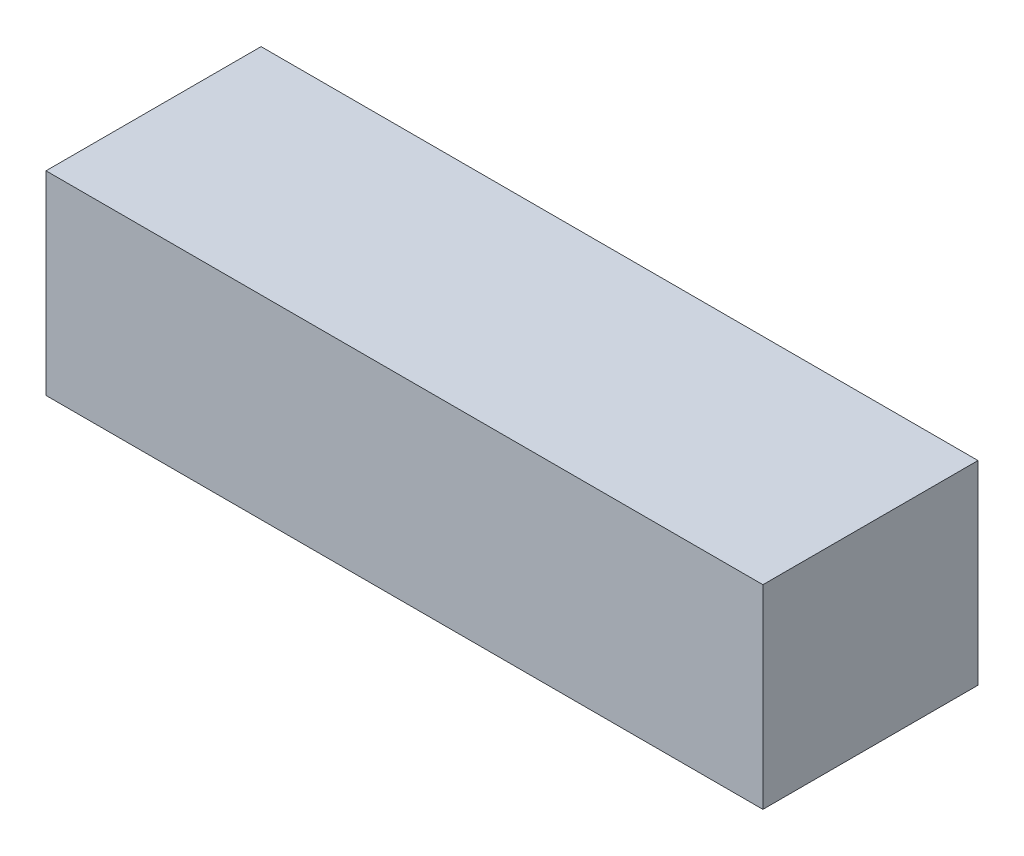
from build123d import *

# Parameters (mm, degrees)
SKETCH1_W           = 140
SKETCH1_H           = 42
BOSS_EXTRUDE1_DEPTH = 38


with BuildPart() as part:
    # Sketch1 → Boss-Extrude1 (new body)
    with BuildSketch(Plane(origin=(0, 0, 0), x_dir=(1, 0, 0), z_dir=(0, 1, 0))):
        Rectangle(SKETCH1_W, SKETCH1_H)
    extrude(amount=BOSS_EXTRUDE1_DEPTH)


solid = part.part
